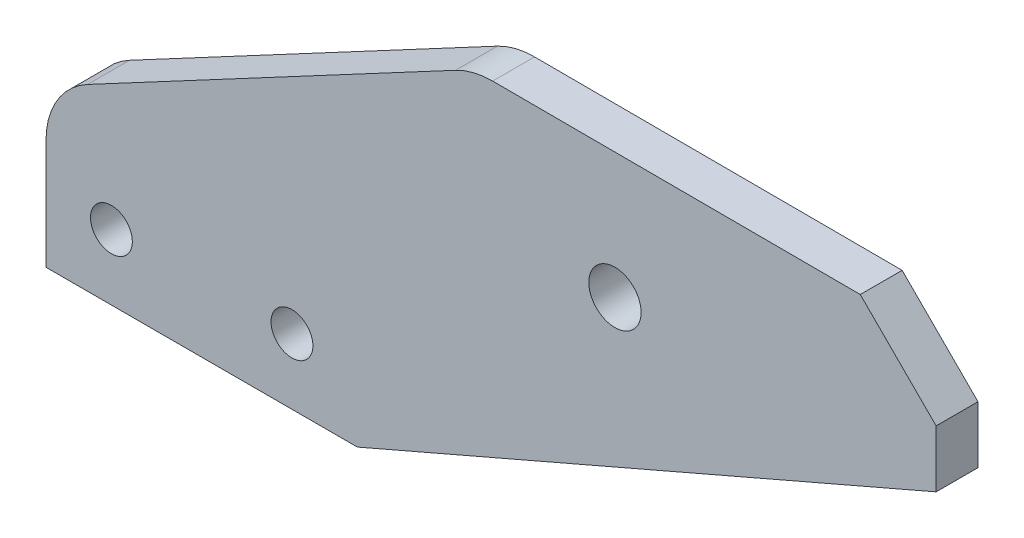
from build123d import *

# Parameters (mm, degrees)
SKETCH1_R           = 2.032
SKETCH1_R_2         = 2.54
BOSS_EXTRUDE1_DEPTH = 4.064


with BuildPart() as part:
    # Sketch1 → Boss-Extrude1 (new body)
    with BuildSketch(Plane.XY):
        with BuildLine():
            Line((0, 0), (0, 10.667831766))
            ThreePointArc((0, 10.667831766), (1.08596755, 14.588395494), (4.034335943, 17.391477598))
            Line((4.034335943, 17.391477598), (39.755950307, 36.44151561))
            ThreePointArc((39.755950307, 36.44151561), (41.504009214, 37.112976763), (43.363043022, 37.337839648))
            Line((43.363043022, 37.337839648), (79.046414123, 37.237491906))
            Line((79.046414123, 37.237491906), (86.410224142, 29.873681887))
            Line((86.410224142, 29.873681887), (86.410224142, 24.325303591))
            Line((86.410224142, 24.325303591), (30.226, 0))
            Line((30.226, 0), (0, 0))
        make_face()
        with Locations((6.35, 6.35)):
            Circle(SKETCH1_R, mode=Mode.SUBTRACT)
        with Locations((23.876, 6.35)):
            Circle(SKETCH1_R, mode=Mode.SUBTRACT)
        with Locations((55.230707363, 25.085785264)):
            Circle(SKETCH1_R_2, mode=Mode.SUBTRACT)
    extrude(amount=-BOSS_EXTRUDE1_DEPTH)


solid = part.part
